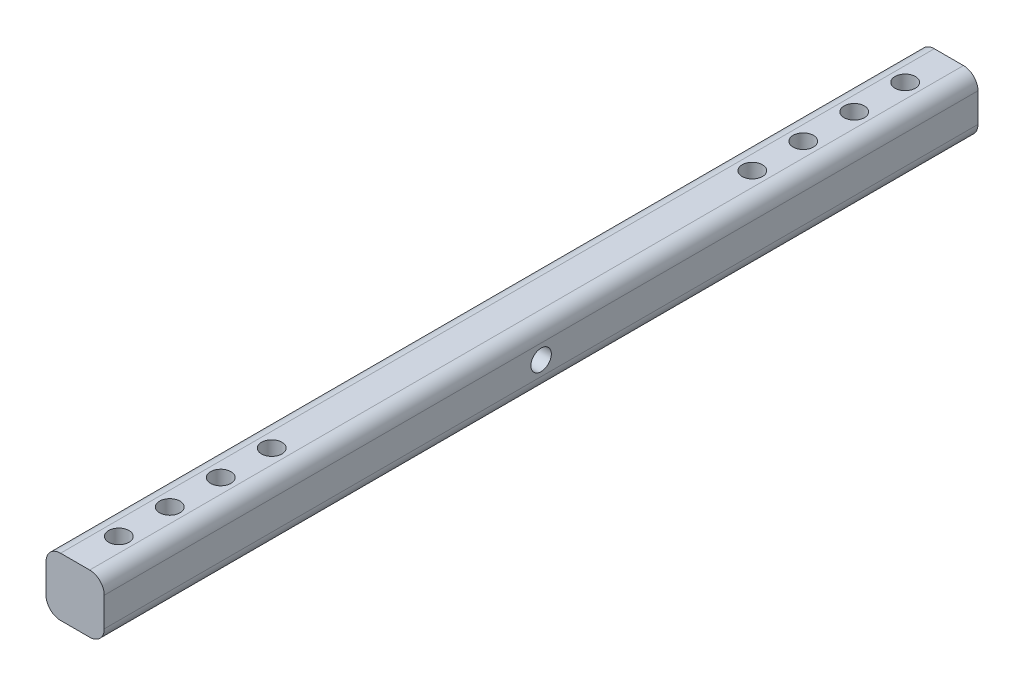
from build123d import *

# Parameters (mm, degrees)
EXTRUDE_1_DEPTH                  = 60
SKETCH_2_R                       = 1.4
CUT_EXTRUDE_1_DEPTH              = 61.663003552
SKETCH_3_R                       = 1.4
CUT_EXTRUDE_2_DEPTH              = 61.663003552
PATTERN_LINEAR_1_COUNT           = 4
PATTERN_LINEAR_1_PITCH           = 7
PATTERN_LINEAR_1_COPY_1_SKETCH_R = 1.4
PATTERN_LINEAR_1_COPY_1_DEPTH    = 61.663003552
PATTERN_LINEAR_1_COPY_2_SKETCH_R = 1.4
PATTERN_LINEAR_1_COPY_2_DEPTH    = 61.663003552
PATTERN_LINEAR_1_COPY_3_SKETCH_R = 1.4
PATTERN_LINEAR_1_COPY_3_DEPTH    = 61.663003552
MIRROR_2_COPY_1_SKETCH_R         = 1.4
MIRROR_2_COPY_1_DEPTH            = 61.663003552
MIRROR_2_COPY_2_SKETCH_R         = 1.4
MIRROR_2_COPY_2_DEPTH            = 61.663003552
MIRROR_2_COPY_3_SKETCH_R         = 1.4
MIRROR_2_COPY_3_DEPTH            = 61.663003552
MIRROR_2_COPY_4_SKETCH_R         = 1.4
MIRROR_2_COPY_4_DEPTH            = 61.663003552
MIRROR_2_COPY_5_SKETCH_R         = 1.4
MIRROR_2_COPY_5_DEPTH            = 61.663003552
MIRROR_2_COPY_6_SKETCH_R         = 1.4
MIRROR_2_COPY_6_DEPTH            = 61.663003552
MIRROR_2_COPY_7_SKETCH_R         = 1.4
MIRROR_2_COPY_7_DEPTH            = 61.663003552
EXTRUDE_2_DEPTH                  = 8
EXTRUDE_START                    = -8
EXTRUDE_3_DEPTH                  = 8


with BuildPart() as part:
    # 草图1 → 凸台-拉伸1 (new, symmetric)
    with BuildSketch(Plane.XY):
        with BuildLine():
            Line((-2, -4), (2, -4))
            ThreePointArc((2, -4), (3.414213562, -3.414213562), (4, -2))
            Line((4, -2), (4, 2))
            ThreePointArc((4, 2), (3.414213562, 3.414213562), (2, 4))
            Line((2, 4), (-2, 4))
            ThreePointArc((-2, 4), (-3.414213562, 3.414213562), (-4, 2))
            Line((-4, 2), (-4, -2))
            ThreePointArc((-4, -2), (-3.414213562, -3.414213562), (-2, -4))
        make_face()
    extrude(amount=EXTRUDE_1_DEPTH, both=True)

    # 草图2 → 切除-拉伸1 (cut, through all)
    with BuildSketch(Plane(origin=(4, 0, 0), x_dir=(0, 0, -1), z_dir=(1, 0, 0))):
        Circle(SKETCH_2_R)
    extrude(amount=-CUT_EXTRUDE_1_DEPTH, mode=Mode.SUBTRACT)

    # 草图3 → 切除-拉伸2 (cut, through all)
    with BuildSketch(Plane(origin=(0, 4, 0), x_dir=(1, 0, 0), z_dir=(0, 1, 0))):
        with Locations(Location((0, -54, 0), (0, 0, 270))):
            Circle(SKETCH_3_R)
    cut_extrude_2 = extrude(amount=-CUT_EXTRUDE_2_DEPTH, mode=Mode.SUBTRACT)

    # 镜向1: 切除-拉伸2 across plane
    add(cut_extrude_2.mirror(Plane.XY), mode=Mode.SUBTRACT)

    # 阵列(线性)1: 切除-拉伸2 ×4
    with Locations(*[(0, 0, i * PATTERN_LINEAR_1_PITCH) for i in range(1, PATTERN_LINEAR_1_COUNT)]):
        add(cut_extrude_2, mode=Mode.SUBTRACT)

    # 阵列(线性)1 copy 1 sketch → 阵列(线性)1 copy 1 (cut, through all)
    with BuildSketch(Plane(origin=(0, 4, 7), x_dir=(1, 0, 0), z_dir=(0, 1, 0))):
        with Locations((0, 54)):
            Circle(PATTERN_LINEAR_1_COPY_1_SKETCH_R)
    extrude(amount=-PATTERN_LINEAR_1_COPY_1_DEPTH, mode=Mode.SUBTRACT)

    # 阵列(线性)1 copy 2 sketch → 阵列(线性)1 copy 2 (cut, through all)
    with BuildSketch(Plane(origin=(0, 4, 14), x_dir=(1, 0, 0), z_dir=(0, 1, 0))):
        with Locations((0, 54)):
            Circle(PATTERN_LINEAR_1_COPY_2_SKETCH_R)
    extrude(amount=-PATTERN_LINEAR_1_COPY_2_DEPTH, mode=Mode.SUBTRACT)

    # 阵列(线性)1 copy 3 sketch → 阵列(线性)1 copy 3 (cut, through all)
    with BuildSketch(Plane(origin=(0, 4, 21), x_dir=(1, 0, 0), z_dir=(0, 1, 0))):
        with Locations((0, 54)):
            Circle(PATTERN_LINEAR_1_COPY_3_SKETCH_R)
    extrude(amount=-PATTERN_LINEAR_1_COPY_3_DEPTH, mode=Mode.SUBTRACT)

    # 镜向2 copy 1 sketch → 镜向2 copy 1 (cut, through all)
    with BuildSketch(Plane(origin=(0, 4, -7), x_dir=(1, 0, 0), z_dir=(0, 1, 0))):
        with Locations((0, 54)):
            Circle(MIRROR_2_COPY_1_SKETCH_R)
    extrude(amount=-MIRROR_2_COPY_1_DEPTH, mode=Mode.SUBTRACT)

    # 镜向2 copy 2 sketch → 镜向2 copy 2 (cut, through all)
    with BuildSketch(Plane(origin=(0, 4, -14), x_dir=(1, 0, 0), z_dir=(0, 1, 0))):
        with Locations((0, 54)):
            Circle(MIRROR_2_COPY_2_SKETCH_R)
    extrude(amount=-MIRROR_2_COPY_2_DEPTH, mode=Mode.SUBTRACT)

    # 镜向2 copy 3 sketch → 镜向2 copy 3 (cut, through all)
    with BuildSketch(Plane(origin=(0, 4, -21), x_dir=(1, 0, 0), z_dir=(0, 1, 0))):
        with Locations((0, 54)):
            Circle(MIRROR_2_COPY_3_SKETCH_R)
    extrude(amount=-MIRROR_2_COPY_3_DEPTH, mode=Mode.SUBTRACT)

    # 镜向2 copy 4 sketch → 镜向2 copy 4 (cut, through all)
    with BuildSketch(Plane(origin=(0, 4, -7), x_dir=(1, 0, 0), z_dir=(0, 1, 0))):
        with Locations(Location((0, -54, 0), (0, 0, 270))):
            Circle(MIRROR_2_COPY_4_SKETCH_R)
    extrude(amount=-MIRROR_2_COPY_4_DEPTH, mode=Mode.SUBTRACT)

    # 镜向2 copy 5 sketch → 镜向2 copy 5 (cut, through all)
    with BuildSketch(Plane(origin=(0, 4, -14), x_dir=(1, 0, 0), z_dir=(0, 1, 0))):
        with Locations(Location((0, -54, 0), (0, 0, 270))):
            Circle(MIRROR_2_COPY_5_SKETCH_R)
    extrude(amount=-MIRROR_2_COPY_5_DEPTH, mode=Mode.SUBTRACT)

    # 镜向2 copy 6 sketch → 镜向2 copy 6 (cut, through all)
    with BuildSketch(Plane(origin=(0, 4, -21), x_dir=(1, 0, 0), z_dir=(0, 1, 0))):
        with Locations(Location((0, -54, 0), (0, 0, 270))):
            Circle(MIRROR_2_COPY_6_SKETCH_R)
    extrude(amount=-MIRROR_2_COPY_6_DEPTH, mode=Mode.SUBTRACT)

    # 镜向2 copy 7 sketch → 镜向2 copy 7 (cut, through all)
    with BuildSketch(Plane(origin=(0, 4, 0), x_dir=(1, 0, 0), z_dir=(0, 1, 0))):
        with Locations((0, 54)):
            Circle(MIRROR_2_COPY_7_SKETCH_R)
    extrude(amount=-MIRROR_2_COPY_7_DEPTH, mode=Mode.SUBTRACT)

    # 草图4 → 凸台-拉伸2 (add)
    with BuildSketch(Plane(origin=(0, 4, 0), x_dir=(1, 0, 0), z_dir=(0, 1, 0))):
        with BuildLine():
            Line((-0.979795897, -60), (0.979795897, -60))
            ThreePointArc((0.979795897, -60), (0, -59.6), (-0.979795897, -60))
        make_face()
    extrude(amount=-EXTRUDE_2_DEPTH)

    # 草图5 → 凸台-拉伸3 (add)
    with BuildSketch(Plane.XZ.offset(4).offset(EXTRUDE_START)):
        with BuildLine():
            Line((-0.979795897, -60), (0.979795897, -60))
            ThreePointArc((0.979795897, -60), (0, -59.6), (-0.979795897, -60))
        make_face()
    extrude(amount=EXTRUDE_3_DEPTH)


solid = part.part
